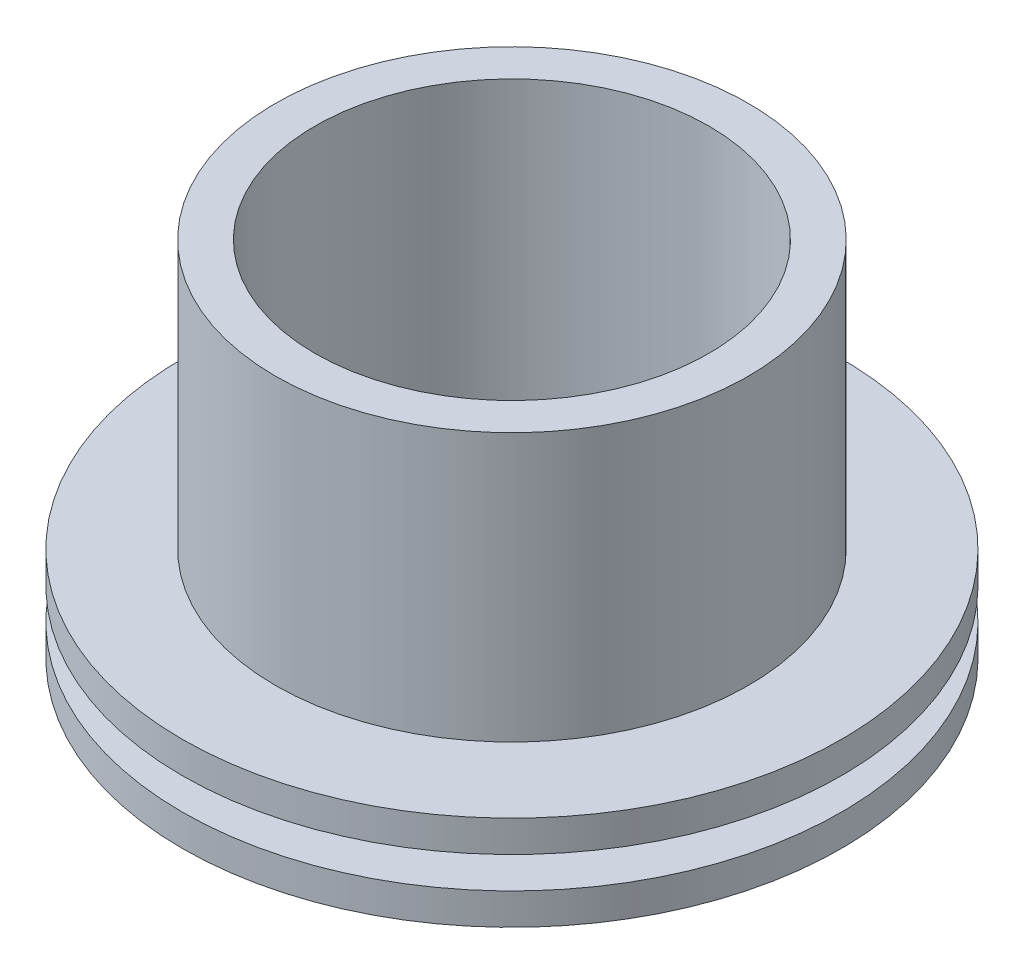
from build123d import *

# Parameters (mm, degrees)
SKETCH1_R           = 15
SKETCH1_R_2         = 12.5
BOSS_EXTRUDE1_DEPTH = 17
BOSS_EXTRUDE2_START = -6
SKETCH1_3_R         = 20.913430936
SKETCH1_3_R_2       = 12.5
BOSS_EXTRUDE2_DEPTH = 6
CUT_EXTRUDE1_START  = -4
SKETCH1_4_R         = 20.913430936
SKETCH1_4_R_2       = 15.913430936
CUT_EXTRUDE1_DEPTH  = 2


with BuildPart() as part:
    # Sketch1 → Boss-Extrude1 (new body)
    with BuildSketch(Plane(origin=(0, 0, 0), x_dir=(1, 0, 0), z_dir=(0, 1, 0))):
        Circle(SKETCH1_R)
        Circle(SKETCH1_R_2, mode=Mode.SUBTRACT)
    extrude(amount=BOSS_EXTRUDE1_DEPTH)

    # Sketch1<3> → Boss-Extrude2 (add)
    with BuildSketch(Plane(origin=(0, 0, 0), x_dir=(1, 0, 0), z_dir=(0, 1, 0)).offset(BOSS_EXTRUDE2_START)):
        Circle(SKETCH1_3_R)
        Circle(SKETCH1_3_R_2, mode=Mode.SUBTRACT)
    extrude(amount=BOSS_EXTRUDE2_DEPTH)

    # Sketch1<4> → Cut-Extrude1 (cut)
    with BuildSketch(Plane(origin=(0, 0, 0), x_dir=(1, 0, 0), z_dir=(0, 1, 0)).offset(CUT_EXTRUDE1_START)):
        Circle(SKETCH1_4_R)
        Circle(SKETCH1_4_R_2, mode=Mode.SUBTRACT)
    extrude(amount=CUT_EXTRUDE1_DEPTH, mode=Mode.SUBTRACT)


solid = part.part
